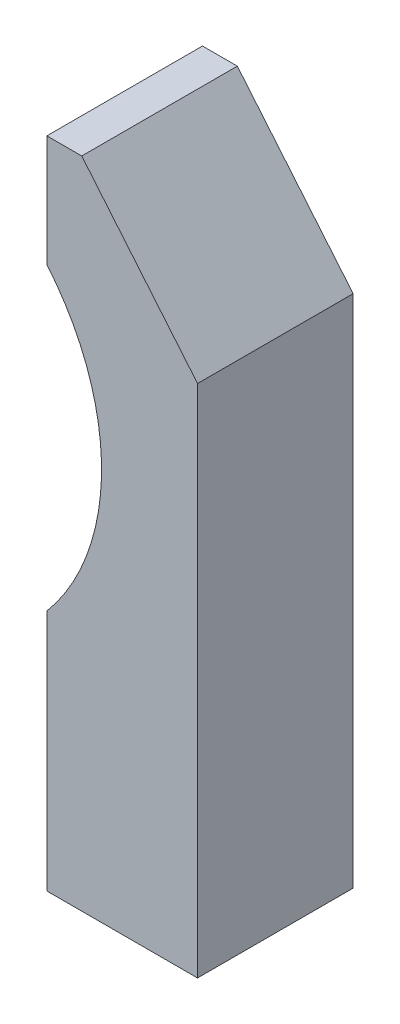
from build123d import *

# Parameters (mm, degrees)
BOSS_EXTRUDE1_DEPTH = 33.02


with BuildPart() as part:
    # Sketch1 → Boss-Extrude1 (new body)
    with BuildSketch(Plane.XY):
        with BuildLine():
            Line((0, 0), (31.968493198, 0))
            Line((31.968493198, 0), (31.968493198, 109.242995925))
            Line((31.968493198, 109.242995925), (7.399294942, 138.771204316))
            Line((7.399294942, 138.771204316), (0, 138.771204316))
            Line((0, 138.771204316), (0, 115.1068086))
            ThreePointArc((0, 115.1068086), (11.60619963, 83.282987393), (0, 51.459166187))
            Line((0, 51.459166187), (0, 0))
        make_face()
    extrude(amount=BOSS_EXTRUDE1_DEPTH)


solid = part.part
